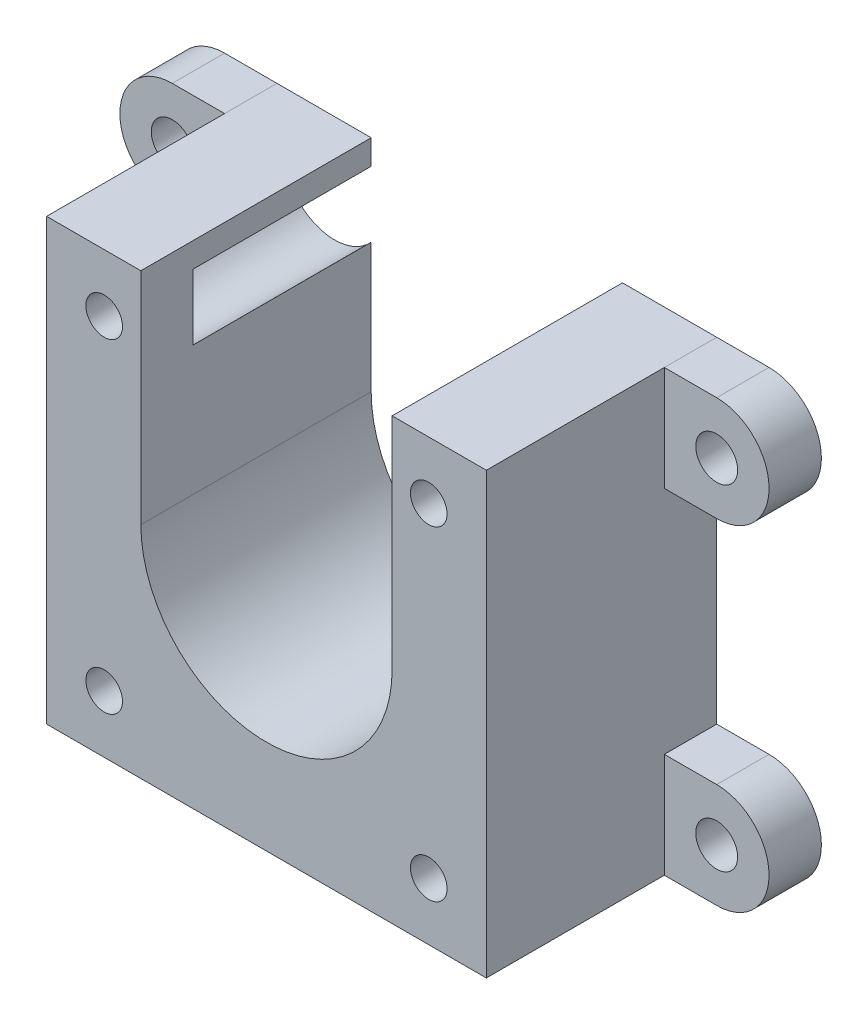
from build123d import *

# Parameters (mm, degrees)
ESBO_O1_R                  = 1.75
RESSALTO_EXTRUS_O1_DEPTH   = 22
ESBO_O2_R                  = 4.7
CORTE_EXTRUS_O1_DEPTH      = 17
ESBO_O4_R                  = 2
RESSALTO_EXTRUS_O2_DEPTH   = 5
RESSALTO_EXTRUS_O2_2_DEPTH = 5
RESSALTO_EXTRUS_O2_3_DEPTH = 5
RESSALTO_EXTRUS_O2_4_DEPTH = 5


with BuildPart() as part:
    # Esboço1 → Ressalto-extrusão1 (new body)
    with BuildSketch(Plane.XY):
        with BuildLine():
            Line((-12, 0), (-12, 21))
            Line((-12, 21), (-21, 21))
            Line((-21, 21), (-21, -21))
            Line((-21, -21), (21, -21))
            Line((21, -21), (21, 21))
            Line((21, 21), (12, 21))
            Line((12, 21), (12, 0))
            ThreePointArc((12, 0), (0, -12), (-12, 0))
        make_face()
        with Locations((-15.5, 15.5)):
            Circle(ESBO_O1_R, mode=Mode.SUBTRACT)
        with Locations((15.5, 15.5)):
            Circle(ESBO_O1_R, mode=Mode.SUBTRACT)
        with Locations((15.5, -15.5)):
            Circle(ESBO_O1_R, mode=Mode.SUBTRACT)
        with Locations((-15.5, -15.5)):
            Circle(ESBO_O1_R, mode=Mode.SUBTRACT)
    extrude(amount=RESSALTO_EXTRUS_O1_DEPTH)

    # Esboço2 → Corte-extrusão1 (cut)
    with BuildSketch(Plane(origin=(0, 0, 0), x_dir=(-1, 0, 0), z_dir=(0, 0, -1))):
        with Locations((-15.5, 15.5)):
            Circle(ESBO_O2_R)
        with Locations((15.5, 15.5)):
            Circle(ESBO_O2_R)
        with Locations((15.5, -15.5)):
            Circle(ESBO_O2_R)
        with Locations((-15.5, -15.5)):
            Circle(ESBO_O2_R)
    extrude(amount=-CORTE_EXTRUS_O1_DEPTH, mode=Mode.SUBTRACT)


with BuildPart() as body_2:
    # Esboço4 → Ressalto-extrusão2 (new body)
    with BuildSketch(Plane(origin=(0, 0, 0), x_dir=(-1, 0, 0), z_dir=(0, 0, -1))):
        with BuildLine():
            Line((-26, 21), (-21, 21))
            Line((-21, 21), (-21, 11))
            Line((-21, 11), (-26, 11))
            ThreePointArc((-26, 11), (-31, 16), (-26, 21))
        make_face()
        with Locations((-26, 16)):
            Circle(ESBO_O4_R, mode=Mode.SUBTRACT)
    extrude(amount=-RESSALTO_EXTRUS_O2_DEPTH)


with BuildPart() as body_3:
    # Esboço4 → Ressalto-extrus_o2 2 (new body)
    with BuildSketch(Plane(origin=(0, 0, 0), x_dir=(-1, 0, 0), z_dir=(0, 0, -1))):
        with BuildLine():
            Line((26, -21), (21, -21))
            Line((21, -21), (21, -11))
            Line((21, -11), (26, -11))
            ThreePointArc((26, -11), (31, -16), (26, -21))
        make_face()
        with Locations((26, -16)):
            Circle(ESBO_O4_R, mode=Mode.SUBTRACT)
    extrude(amount=-RESSALTO_EXTRUS_O2_2_DEPTH)


with BuildPart() as body_4:
    # Esboço4 → Ressalto-extrus_o2 3 (new body)
    with BuildSketch(Plane(origin=(0, 0, 0), x_dir=(-1, 0, 0), z_dir=(0, 0, -1))):
        with BuildLine():
            Line((-21, -21), (-21, -11))
            Line((-21, -11), (-26, -11))
            ThreePointArc((-26, -11), (-31, -16), (-26, -21))
            Line((-26, -21), (-21, -21))
        make_face()
        with Locations(Location((-26, -16, 0), (0, 0, 180))):
            Circle(ESBO_O4_R, mode=Mode.SUBTRACT)
    extrude(amount=-RESSALTO_EXTRUS_O2_3_DEPTH)


with BuildPart() as body_5:
    # Esboço4 → Ressalto-extrus_o2 4 (new body)
    with BuildSketch(Plane(origin=(0, 0, 0), x_dir=(-1, 0, 0), z_dir=(0, 0, -1))):
        with BuildLine():
            Line((21, 21), (21, 11))
            Line((21, 11), (26, 11))
            ThreePointArc((26, 11), (31, 16), (26, 21))
            Line((26, 21), (21, 21))
        make_face()
        with Locations(Location((26, 16, 0), (0, 0, 180))):
            Circle(ESBO_O4_R, mode=Mode.SUBTRACT)
    extrude(amount=-RESSALTO_EXTRUS_O2_4_DEPTH)


solid = Compound([part.part, body_2.part, body_3.part, body_4.part, body_5.part])
